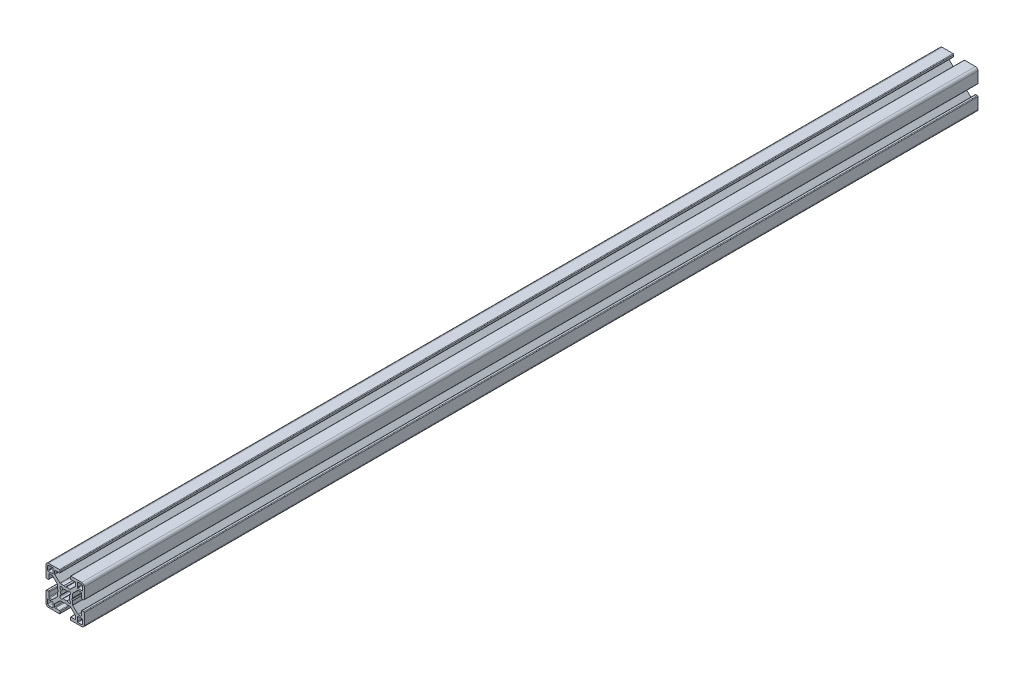
from build123d import *

# Parameters (mm, degrees)
EXTRUDE1_DEPTH = 700


with BuildPart() as part:
    # Sketch1 → Extrude1 (new body)
    with BuildSketch(Plane.XY):
        with BuildLine():
            Line((12.74247465, -4.5), (12.74247465, -7.732519321))
            ThreePointArc((12.74247465, -7.732519321), (12.602449697, -8.097296796), (12.242781236, -8.249967))
            Line((12.242781236, -8.249967), (10.260188032, -8.249967))
            ThreePointArc((10.260188032, -8.249967), (10.068847082, -8.211906919), (9.906636056, -8.103520976))
            Line((9.906636056, -8.103520976), (5.981117769, -4.178002689))
            ThreePointArc((5.981117769, -4.178002689), (5.872731827, -4.015791664), (5.834671745, -3.824450713))
            Line((5.834671745, -3.824450713), (5.834671745, -1.01249595))
            Line((5.834671745, -1.01249595), (5.324673785, -0.06249975))
            Line((5.324673785, -0.06249975), (5.834671745, 0.88749645))
            Line((5.834671745, 0.88749645), (5.834671745, 3.824450713))
            ThreePointArc((5.834671745, 3.824450713), (5.872731827, 4.015791664), (5.981117769, 4.178002689))
            Line((5.981117769, 4.178002689), (9.906636056, 8.103520976))
            ThreePointArc((9.906636056, 8.103520976), (10.068847082, 8.211906919), (10.260188032, 8.249967))
            Line((10.260188032, 8.249967), (12.242781236, 8.249967))
            ThreePointArc((12.242781236, 8.249967), (12.602449697, 8.097296796), (12.74247465, 7.732519321))
            Line((12.74247465, 7.732519321), (12.74247465, 4.5))
            ThreePointArc((12.74247465, 4.5), (12.88892126, 4.146446609), (13.24247465, 4))
            Line((13.24247465, 4), (14.49994, 4))
            ThreePointArc((14.49994, 4), (14.853493391, 4.146446609), (14.99994, 4.5))
            Line((14.99994, 4.5), (14.99994, 12.999948))
            ThreePointArc((14.99994, 12.999948), (14.414155906, 14.414155906), (12.999948, 14.99994))
            Line((12.999948, 14.99994), (4.5, 14.99994))
            ThreePointArc((4.5, 14.99994), (4.146446609, 14.853493391), (4, 14.49994))
            Line((4, 14.49994), (4, 13.24247465))
            ThreePointArc((4, 13.24247465), (4.146446609, 12.88892126), (4.5, 12.74247465))
            Line((4.5, 12.74247465), (7.732519321, 12.74247465))
            ThreePointArc((7.732519321, 12.74247465), (8.097296796, 12.602449697), (8.249967, 12.242781236))
            Line((8.249967, 12.242781236), (8.249967, 10.260188032))
            ThreePointArc((8.249967, 10.260188032), (8.211906919, 10.068847082), (8.103520976, 9.906636056))
            Line((8.103520976, 9.906636056), (4.178002689, 5.981117769))
            ThreePointArc((4.178002689, 5.981117769), (4.015791664, 5.872731827), (3.824450713, 5.834671745))
            Line((3.824450713, 5.834671745), (0.9499962, 5.834671745))
            Line((0.9499962, 5.834671745), (0, 5.324673785))
            Line((0, 5.324673785), (-0.9499962, 5.834671745))
            Line((-0.9499962, 5.834671745), (-3.824450713, 5.834671745))
            ThreePointArc((-3.824450713, 5.834671745), (-4.015791664, 5.872731827), (-4.178002689, 5.981117769))
            Line((-4.178002689, 5.981117769), (-8.103520976, 9.906636056))
            ThreePointArc((-8.103520976, 9.906636056), (-8.211906919, 10.068847082), (-8.249967, 10.260188032))
            Line((-8.249967, 10.260188032), (-8.249967, 12.242781236))
            ThreePointArc((-8.249967, 12.242781236), (-8.097296796, 12.602449697), (-7.732519321, 12.74247465))
            Line((-7.732519321, 12.74247465), (-4.5, 12.74247465))
            ThreePointArc((-4.5, 12.74247465), (-4.146446609, 12.88892126), (-4, 13.24247465))
            Line((-4, 13.24247465), (-4, 14.49994))
            ThreePointArc((-4, 14.49994), (-4.146446609, 14.853493391), (-4.5, 14.99994))
            Line((-4.5, 14.99994), (-12.999948, 14.99994))
            ThreePointArc((-12.999948, 14.99994), (-14.414155906, 14.414155906), (-14.99994, 12.999948))
            Line((-14.99994, 12.999948), (-14.99994, 4.5))
            ThreePointArc((-14.99994, 4.5), (-14.853493391, 4.146446609), (-14.49994, 4))
            Line((-14.49994, 4), (-13.24247465, 4))
            ThreePointArc((-13.24247465, 4), (-12.88892126, 4.146446609), (-12.74247465, 4.5))
            Line((-12.74247465, 4.5), (-12.74247465, 7.732519321))
            ThreePointArc((-12.74247465, 7.732519321), (-12.602449697, 8.097296796), (-12.242781236, 8.249967))
            Line((-12.242781236, 8.249967), (-10.260188032, 8.249967))
            ThreePointArc((-10.260188032, 8.249967), (-10.068847082, 8.211906919), (-9.906636056, 8.103520976))
            Line((-9.906636056, 8.103520976), (-5.981117769, 4.178002689))
            ThreePointArc((-5.981117769, 4.178002689), (-5.872731827, 4.015791664), (-5.834671745, 3.824450713))
            Line((-5.834671745, 3.824450713), (-5.834671745, 0.88749645))
            Line((-5.834671745, 0.88749645), (-5.324673785, -0.06249975))
            Line((-5.324673785, -0.06249975), (-5.834671745, -1.01249595))
            Line((-5.834671745, -1.01249595), (-5.834671745, -3.824450713))
            ThreePointArc((-5.834671745, -3.824450713), (-5.872731827, -4.015791664), (-5.981117769, -4.178002689))
            Line((-5.981117769, -4.178002689), (-9.906636056, -8.103520976))
            ThreePointArc((-9.906636056, -8.103520976), (-10.068847082, -8.211906919), (-10.260188032, -8.249967))
            Line((-10.260188032, -8.249967), (-12.242781236, -8.249967))
            ThreePointArc((-12.242781236, -8.249967), (-12.602449697, -8.097296796), (-12.74247465, -7.732519321))
            Line((-12.74247465, -7.732519321), (-12.74247465, -4.5))
            ThreePointArc((-12.74247465, -4.5), (-12.88892126, -4.146446609), (-13.24247465, -4))
            Line((-13.24247465, -4), (-14.49994, -4))
            ThreePointArc((-14.49994, -4), (-14.853493391, -4.146446609), (-14.99994, -4.5))
            Line((-14.99994, -4.5), (-14.99994, -12.999948))
            ThreePointArc((-14.99994, -12.999948), (-14.414155906, -14.414155906), (-12.999948, -14.99994))
            Line((-12.999948, -14.99994), (-4.5, -14.99994))
            ThreePointArc((-4.5, -14.99994), (-4.146446609, -14.853493391), (-4, -14.49994))
            Line((-4, -14.49994), (-4, -13.24247465))
            ThreePointArc((-4, -13.24247465), (-4.146446609, -12.88892126), (-4.5, -12.74247465))
            Line((-4.5, -12.74247465), (-7.732519321, -12.74247465))
            ThreePointArc((-7.732519321, -12.74247465), (-8.097296796, -12.602449697), (-8.249967, -12.242781236))
            Line((-8.249967, -12.242781236), (-8.249967, -10.260188032))
            ThreePointArc((-8.249967, -10.260188032), (-8.211906919, -10.068847082), (-8.103520976, -9.906636056))
            Line((-8.103520976, -9.906636056), (-4.178002689, -5.981117769))
            ThreePointArc((-4.178002689, -5.981117769), (-4.015791664, -5.872731827), (-3.824450713, -5.834671745))
            Line((-3.824450713, -5.834671745), (-0.9499962, -5.834671745))
            Line((-0.9499962, -5.834671745), (0, -5.324673785))
            Line((0, -5.324673785), (0.9499962, -5.834671745))
            Line((0.9499962, -5.834671745), (3.824450713, -5.834671745))
            ThreePointArc((3.824450713, -5.834671745), (4.015791664, -5.872731827), (4.178002689, -5.981117769))
            Line((4.178002689, -5.981117769), (8.103520976, -9.906636056))
            ThreePointArc((8.103520976, -9.906636056), (8.211906919, -10.068847082), (8.249967, -10.260188032))
            Line((8.249967, -10.260188032), (8.249967, -12.242781236))
            ThreePointArc((8.249967, -12.242781236), (8.097296796, -12.602449697), (7.732519321, -12.74247465))
            Line((7.732519321, -12.74247465), (4.5, -12.74247465))
            ThreePointArc((4.5, -12.74247465), (4.146446609, -12.88892126), (4, -13.24247465))
            Line((4, -13.24247465), (4, -14.49994))
            ThreePointArc((4, -14.49994), (4.146446609, -14.853493391), (4.5, -14.99994))
            Line((4.5, -14.99994), (12.999948, -14.99994))
            ThreePointArc((12.999948, -14.99994), (14.414155906, -14.414155906), (14.99994, -12.999948))
            Line((14.99994, -12.999948), (14.99994, -4.5))
            ThreePointArc((14.99994, -4.5), (14.853493391, -4.146446609), (14.49994, -4))
            Line((14.49994, -4), (13.24247465, -4))
            ThreePointArc((13.24247465, -4), (12.88892126, -4.146446609), (12.74247465, -4.5))
        make_face()
        with BuildLine():
            Line((9.499962, -13.318946724), (9.499962, -9.87996048))
            ThreePointArc((9.499962, -9.87996048), (9.611260978, -9.611260978), (9.87996048, -9.499962))
            Line((9.87996048, -9.499962), (13.318946724, -9.499962))
            ThreePointArc((13.318946724, -9.499962), (13.58835333, -9.61155387), (13.6999452, -9.880960476))
            Line((13.6999452, -9.880960476), (13.6999452, -12.6999492))
            ThreePointArc((13.6999452, -12.6999492), (13.407053153, -13.407053153), (12.6999492, -13.6999452))
            Line((12.6999492, -13.6999452), (9.880960476, -13.6999452))
            ThreePointArc((9.880960476, -13.6999452), (9.61155387, -13.58835333), (9.499962, -13.318946724))
        make_face(mode=Mode.SUBTRACT)
        with BuildLine():
            Line((-13.318946724, -9.499962), (-9.87996048, -9.499962))
            ThreePointArc((-9.87996048, -9.499962), (-9.611260978, -9.611260978), (-9.499962, -9.87996048))
            Line((-9.499962, -9.87996048), (-9.499962, -13.318946724))
            ThreePointArc((-9.499962, -13.318946724), (-9.61155387, -13.58835333), (-9.880960476, -13.6999452))
            Line((-9.880960476, -13.6999452), (-12.6999492, -13.6999452))
            ThreePointArc((-12.6999492, -13.6999452), (-13.407053153, -13.407053153), (-13.6999452, -12.6999492))
            Line((-13.6999452, -12.6999492), (-13.6999452, -9.880960476))
            ThreePointArc((-13.6999452, -9.880960476), (-13.58835333, -9.61155387), (-13.318946724, -9.499962))
        make_face(mode=Mode.SUBTRACT)
        with BuildLine():
            Line((-1.494225248, -3.198138712), (-2.473341823, -3.979927146))
            ThreePointArc((-2.473341823, -3.979927146), (-3.900227701, -3.900227701), (-3.979927146, -2.473341823))
            Line((-3.979927146, -2.473341823), (-3.198138712, -1.494225248))
            ThreePointArc((-3.198138712, -1.494225248), (-3.52998588, 0), (-3.198138712, 1.494225248))
            Line((-3.198138712, 1.494225248), (-3.979927146, 2.473341823))
            ThreePointArc((-3.979927146, 2.473341823), (-3.900227701, 3.900227701), (-2.473341823, 3.979927146))
            Line((-2.473341823, 3.979927146), (-1.494225248, 3.198138712))
            ThreePointArc((-1.494225248, 3.198138712), (0, 3.52998588), (1.494225248, 3.198138712))
            Line((1.494225248, 3.198138712), (2.473341823, 3.979927146))
            ThreePointArc((2.473341823, 3.979927146), (3.900227701, 3.900227701), (3.979927146, 2.473341823))
            Line((3.979927146, 2.473341823), (3.198138712, 1.494225248))
            ThreePointArc((3.198138712, 1.494225248), (3.52998588, 0), (3.198138712, -1.494225248))
            Line((3.198138712, -1.494225248), (3.979927146, -2.473341823))
            ThreePointArc((3.979927146, -2.473341823), (3.900227701, -3.900227701), (2.473341823, -3.979927146))
            Line((2.473341823, -3.979927146), (1.494225248, -3.198138712))
            ThreePointArc((1.494225248, -3.198138712), (0, -3.52998588), (-1.494225248, -3.198138712))
        make_face(mode=Mode.SUBTRACT)
        with BuildLine():
            Line((-9.499962, 13.318946724), (-9.499962, 9.87996048))
            ThreePointArc((-9.499962, 9.87996048), (-9.611260978, 9.611260978), (-9.87996048, 9.499962))
            Line((-9.87996048, 9.499962), (-13.318946724, 9.499962))
            ThreePointArc((-13.318946724, 9.499962), (-13.58835333, 9.61155387), (-13.6999452, 9.880960476))
            Line((-13.6999452, 9.880960476), (-13.6999452, 12.6999492))
            ThreePointArc((-13.6999452, 12.6999492), (-13.407053153, 13.407053153), (-12.6999492, 13.6999452))
            Line((-12.6999492, 13.6999452), (-9.880960476, 13.6999452))
            ThreePointArc((-9.880960476, 13.6999452), (-9.61155387, 13.58835333), (-9.499962, 13.318946724))
        make_face(mode=Mode.SUBTRACT)
        with BuildLine():
            Line((9.880960476, 13.6999452), (12.6999492, 13.6999452))
            ThreePointArc((12.6999492, 13.6999452), (13.407053153, 13.407053153), (13.6999452, 12.6999492))
            Line((13.6999452, 12.6999492), (13.6999452, 9.880960476))
            ThreePointArc((13.6999452, 9.880960476), (13.58835333, 9.61155387), (13.318946724, 9.499962))
            Line((13.318946724, 9.499962), (9.87996048, 9.499962))
            ThreePointArc((9.87996048, 9.499962), (9.611260978, 9.611260978), (9.499962, 9.87996048))
            Line((9.499962, 9.87996048), (9.499962, 13.318946724))
            ThreePointArc((9.499962, 13.318946724), (9.61155387, 13.58835333), (9.880960476, 13.6999452))
        make_face(mode=Mode.SUBTRACT)
    extrude(amount=-EXTRUDE1_DEPTH)


solid = part.part
